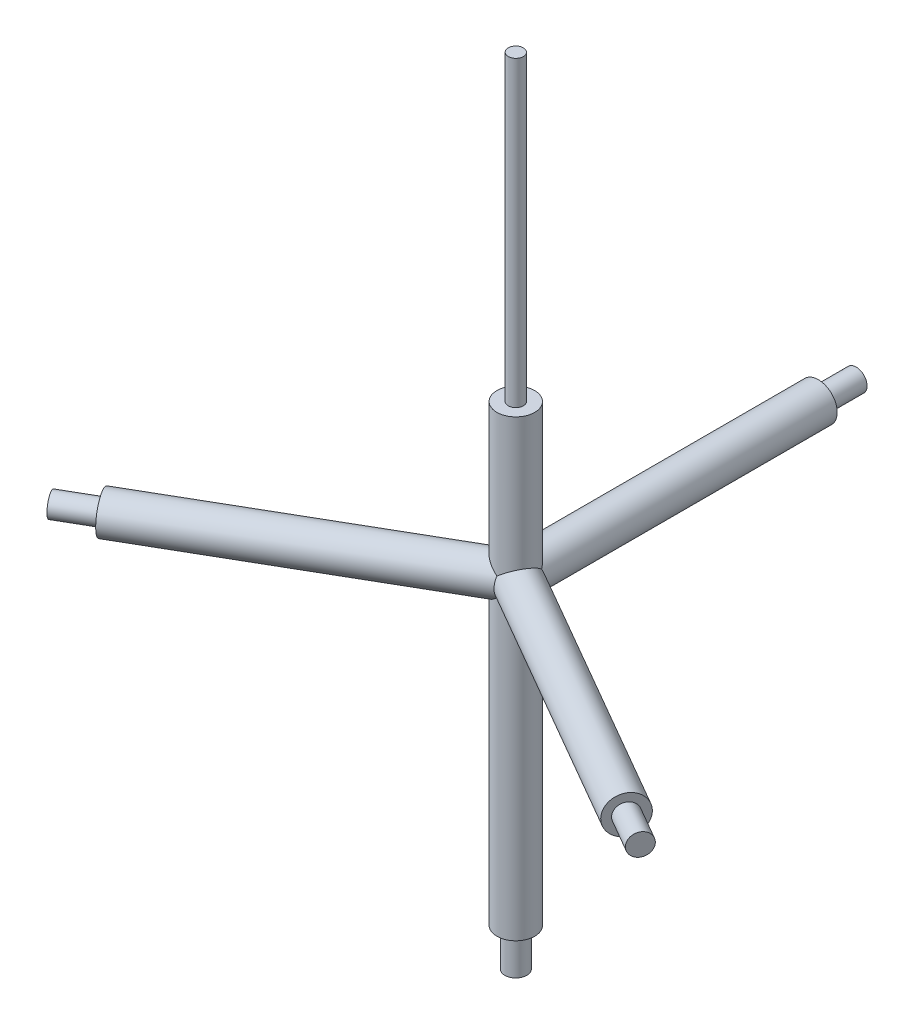
from build123d import *

# Parameters (mm, degrees)
SKETCH_1_W                 = 2.5
SKETCH_1_H                 = 40
SKETCH_8_R                 = 1.45
EXTRUDE_2_DEPTH            = 5
PATTERN_CIRCULAR_760_COUNT = 3
EXTRUDE_2_2_DEPTH          = 20
EXTRUDE_2_2_DEPTH_BACK     = 40
SKETCH_5_R                 = 2.5
SKETCH_6_R                 = 1
EXTRUDE_1_DEPTH            = 40
PATTERN_CIRCULAR_1_COUNT   = 3
SKETCH_9_R                 = 1.45
EXTRUDE_3_DEPTH            = 5


with BuildPart() as part:
    # 草图1 → 杆件1 (revolve)
    with BuildSketch(Plane(origin=(0, 0, 0), x_dir=(1, 0, 0), z_dir=(0, 1, 0)), mode=Mode.PRIVATE) as revolve_1_sk:
        with Locations((-1.25, 20)):
            Rectangle(SKETCH_1_W, SKETCH_1_H)
    revolve_1 = revolve(revolve_1_sk.sketch.rotate(Axis((0, 0, 0), (0, 0, -1)), 180), axis=Axis((0, 0, 0), (0, 0, -1)))

    # 草图8 → Extrude 2 (add)
    with BuildSketch(Plane(origin=(0, 0, -40), x_dir=(-1, 0, 0), z_dir=(0, 0, -1))):
        Circle(SKETCH_8_R)
    extrude_2 = extrude(amount=EXTRUDE_2_DEPTH)

    # Pattern Circular 760: 杆件1 ×3 about axis
    pattern_circular_760_axis = Axis((0, 0, 0), (0, 1, 0))
    for i in range(1, PATTERN_CIRCULAR_760_COUNT):
        add(revolve_1.rotate(pattern_circular_760_axis, i * 360 / PATTERN_CIRCULAR_760_COUNT))

    # 草图5 → Extrude 2 2 (add, two sides: drawn at the far end of the back side and taken through both)
    with BuildSketch(Plane(origin=(0, 0, 0), x_dir=(1, 0, 0), z_dir=(0, 1, 0)).offset(-EXTRUDE_2_2_DEPTH_BACK)):
        with Locations(Location((0, 0, 0), (0, 0, 270))):
            Circle(SKETCH_5_R)
    extrude(amount=EXTRUDE_2_2_DEPTH + EXTRUDE_2_2_DEPTH_BACK)

    # 草图6 → 凸台-拉伸1 (add)
    with BuildSketch(Plane(origin=(0, 20, 0), x_dir=(1, 0, 0), z_dir=(0, 1, 0))):
        with Locations(Location((0, 0, 0), (0, 0, 270))):
            Circle(SKETCH_6_R)
    extrude(amount=EXTRUDE_1_DEPTH)

    # 阵列(圆周)1: Extrude 2 ×3 about axis
    pattern_circular_1_axis = Axis((0, 0, 0), (0, 1, 0))
    for i in range(1, PATTERN_CIRCULAR_1_COUNT):
        add(extrude_2.rotate(pattern_circular_1_axis, i * 360 / PATTERN_CIRCULAR_1_COUNT))

    # 草图9 → 凸台-拉伸3 (add)
    with BuildSketch(Plane.XZ.offset(40)):
        with Locations(Location((0, 0, 0), (0, 0, 270))):
            Circle(SKETCH_9_R)
    extrude(amount=EXTRUDE_3_DEPTH)


solid = part.part
